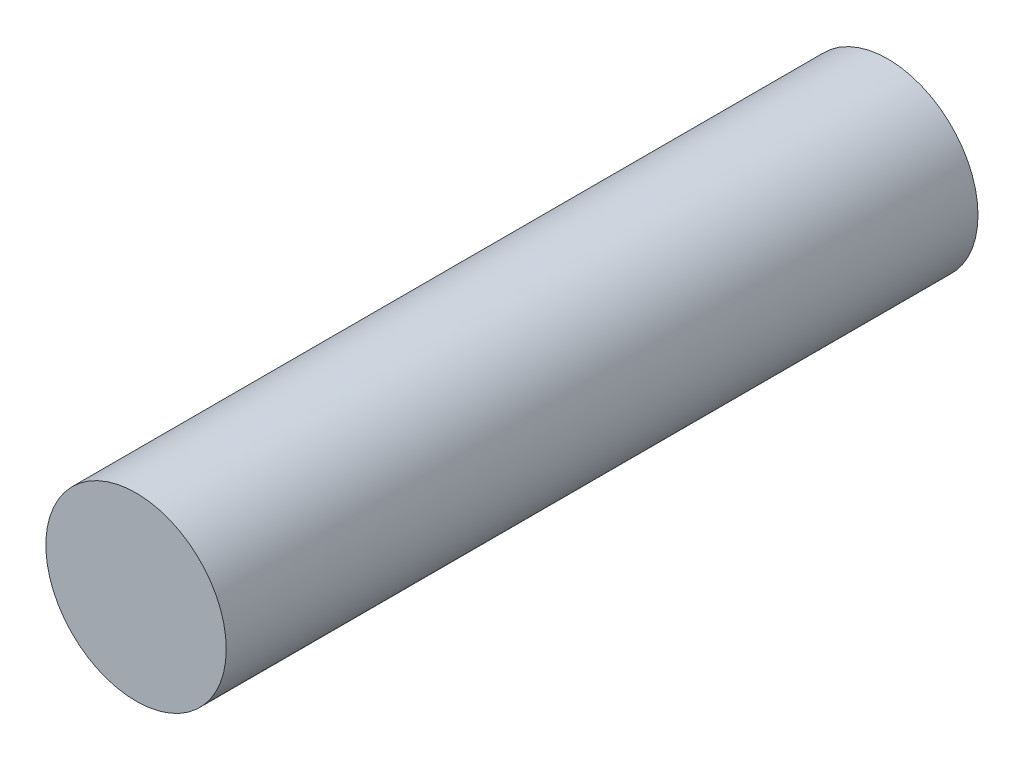
from build123d import *

# Parameters (mm, degrees)
ESQUISSE2_R        = 6
BOSS_EXTRU_1_DEPTH = 50


with BuildPart() as part:
    # Esquisse2 → Boss.-Extru.1 (new body)
    with BuildSketch(Plane.XY):
        Circle(ESQUISSE2_R)
    extrude(amount=BOSS_EXTRU_1_DEPTH)


solid = part.part
